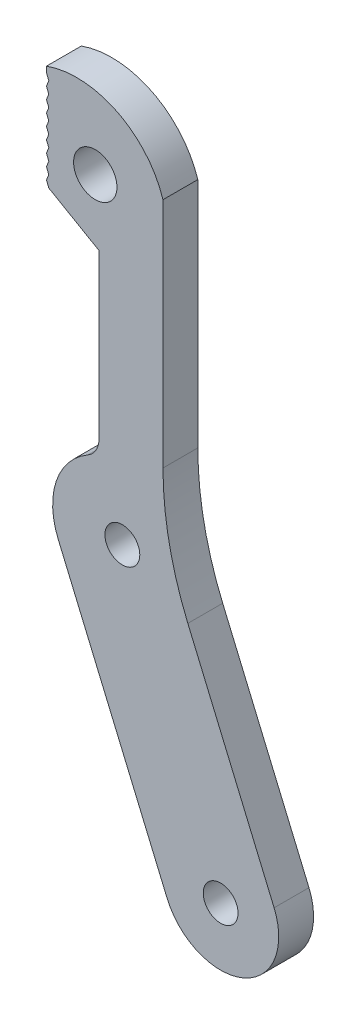
from build123d import *

# Parameters (mm, degrees)
SKETCH1_R           = 1.5
SKETCH1_R_2         = 1.866773139
BOSS_EXTRUDE2_DEPTH = 3


with BuildPart() as part:
    # Sketch1 → Boss-Extrude2 (new body)
    with BuildSketch(Plane.XY):
        with BuildLine():
            Line((19.955328479, -21.686654411), (19.955328479, -7.686654411))
            Line((19.955328479, -7.686654411), (15.62520146, -5.186654411))
            Line((15.62520146, -5.186654411), (15.42520146, -4.686654411))
            Line((15.42520146, -4.686654411), (15.62520146, -4.186654411))
            Line((15.62520146, -4.186654411), (15.42520146, -3.686654411))
            Line((15.42520146, -3.686654411), (15.62520146, -3.186654411))
            Line((15.62520146, -3.186654411), (15.42520146, -2.686654411))
            Line((15.42520146, -2.686654411), (15.62520146, -2.186654411))
            Line((15.62520146, -2.186654411), (15.42520146, -1.686654411))
            Line((15.42520146, -1.686654411), (15.62520146, -1.186654411))
            Line((15.62520146, -1.186654411), (15.42520146, -0.686654411))
            Line((15.42520146, -0.686654411), (15.62520146, -0.186654411))
            Line((15.62520146, -0.186654411), (15.42520146, 0.313345589))
            Line((15.42520146, 0.313345589), (15.62520146, 0.813345589))
            Line((15.62520146, 0.813345589), (15.42520146, 1.313345589))
            Line((15.42520146, 1.313345589), (15.62520146, 1.813345589))
            Line((15.62520146, 1.813345589), (15.42520146, 2.313345589))
            Line((15.42520146, 2.313345589), (15.62520146, 2.813345589))
            Line((15.62520146, 2.813345589), (15.42520146, 3.313345589))
            Line((15.42520146, 3.313345589), (15.42520146, 3.802153535))
            ThreePointArc((15.42520146, 3.802153535), (21.487107687, 3.455011814), (25.455328479, -1.140685983))
            Line((25.455328479, -1.140685983), (25.455328479, -21.140685983))
            ThreePointArc((25.455328479, -21.140685983), (25.995551768, -26.504062064), (27.594518651, -31.651969317))
            Line((27.594518651, -31.651969317), (35.020472422, -49.140685983))
            ThreePointArc((35.020472422, -49.140685983), (32.372376923, -55.697178203), (25.815884703, -53.049082704))
            Line((25.815884703, -53.049082704), (16.435732572, -30.958072179))
            ThreePointArc((16.435732572, -30.958072179), (16.267997475, -26.710838203), (18.95611766, -23.418249345))
            ThreePointArc((18.95611766, -23.418249345), (19.687607088, -22.686259743), (19.955328479, -21.686654411))
        make_face()
        with Locations((30.418178563, -51.094884343)):
            Circle(SKETCH1_R, mode=Mode.SUBTRACT)
        with Locations((19.62520146, -2.186654411)):
            Circle(SKETCH1_R_2, mode=Mode.SUBTRACT)
        with Locations((21.958485203, -28.613034147)):
            Circle(SKETCH1_R, mode=Mode.SUBTRACT)
    extrude(amount=BOSS_EXTRUDE2_DEPTH)


solid = part.part
